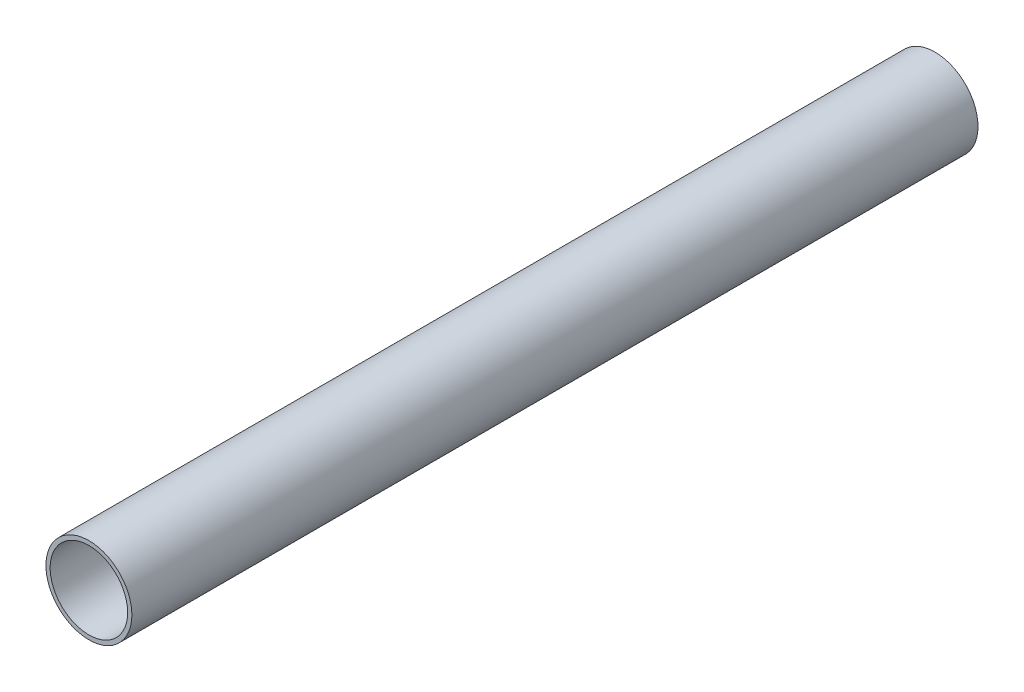
from build123d import *

# Parameters (mm, degrees)
CROQUIS1_R              = 101.6
CROQUIS1_R_2            = 91.6
SALIENTE_EXTRUIR1_DEPTH = 2000


with BuildPart() as part:
    # Croquis1 → Saliente-Extruir1 (new body)
    with BuildSketch(Plane.XY):
        Circle(CROQUIS1_R)
        Circle(CROQUIS1_R_2, mode=Mode.SUBTRACT)
    extrude(amount=SALIENTE_EXTRUIR1_DEPTH)


solid = part.part
